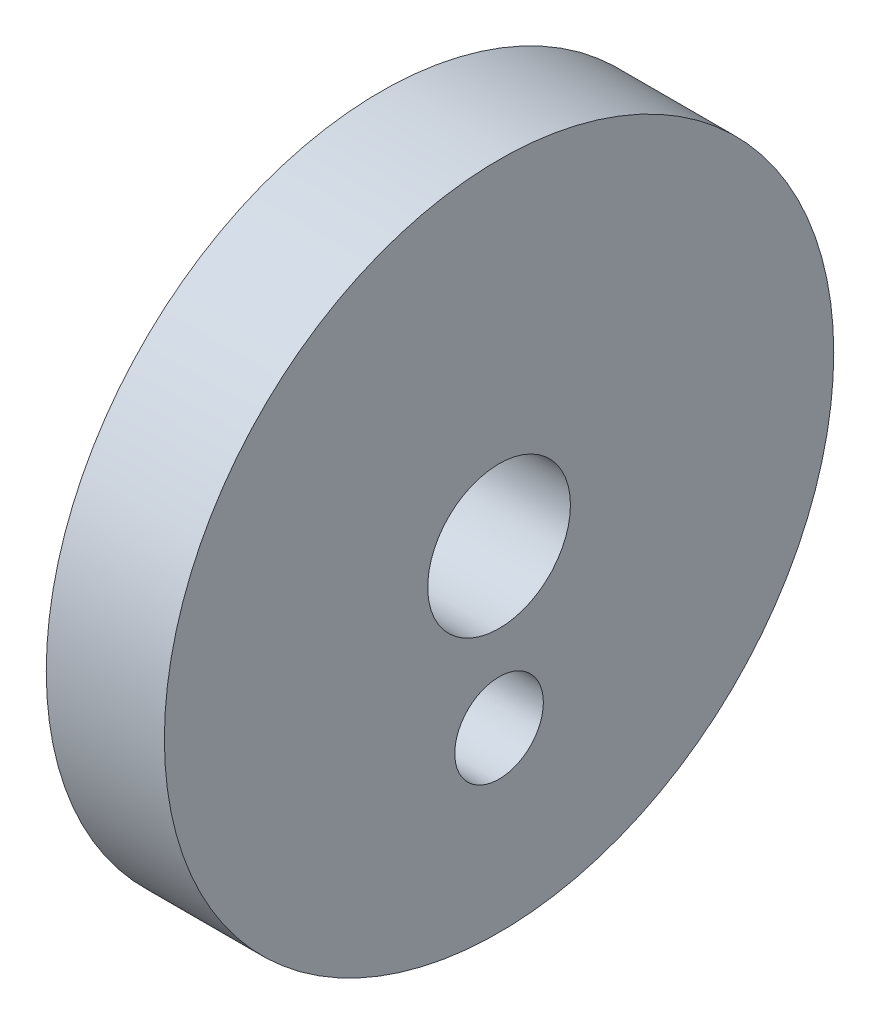
from build123d import *

# Parameters (mm, degrees)
SKETCH1_R                 = 34
BOSS_EXTRUDE1_DEPTH       = 12
M13_CLEARANCE_HOLE1_D     = 14.5
M13_CLEARANCE_HOLE1_DEPTH = 30
M13_CLEARANCE_HOLE1_TIP   = 4.356239488
M8_CLEARANCE_HOLE1_D      = 9
M8_CLEARANCE_HOLE1_DEPTH  = 30
M8_CLEARANCE_HOLE1_TIP    = 2.703872786


with BuildPart() as part:
    # Sketch1 → Boss-Extrude1 (new body)
    with BuildSketch(Plane(origin=(0, 0, 0), x_dir=(0, 0, -1), z_dir=(1, 0, 0))):
        Circle(SKETCH1_R)
    extrude(amount=BOSS_EXTRUDE1_DEPTH)

    # M13 Clearance Hole1
    with Locations(Plane(origin=(12, 0, 0), x_dir=(0, 0, -1), z_dir=(1, 0, 0))):
        with Locations((0, 0)):
            Hole(M13_CLEARANCE_HOLE1_D / 2, depth=M13_CLEARANCE_HOLE1_DEPTH)
            with Locations((0, 0, -(M13_CLEARANCE_HOLE1_DEPTH + M13_CLEARANCE_HOLE1_TIP / 2))):  # 118° drill point
                Cone(0, M13_CLEARANCE_HOLE1_D / 2, M13_CLEARANCE_HOLE1_TIP, mode=Mode.SUBTRACT)

    # M8 Clearance Hole1
    with Locations(Plane(origin=(12, 0, 0), x_dir=(0, 0, -1), z_dir=(1, 0, 0))):
        with Locations((0, -16)):
            Hole(M8_CLEARANCE_HOLE1_D / 2, depth=M8_CLEARANCE_HOLE1_DEPTH)
            with Locations((0, 0, -(M8_CLEARANCE_HOLE1_DEPTH + M8_CLEARANCE_HOLE1_TIP / 2))):  # 118° drill point
                Cone(0, M8_CLEARANCE_HOLE1_D / 2, M8_CLEARANCE_HOLE1_TIP, mode=Mode.SUBTRACT)


solid = part.part
